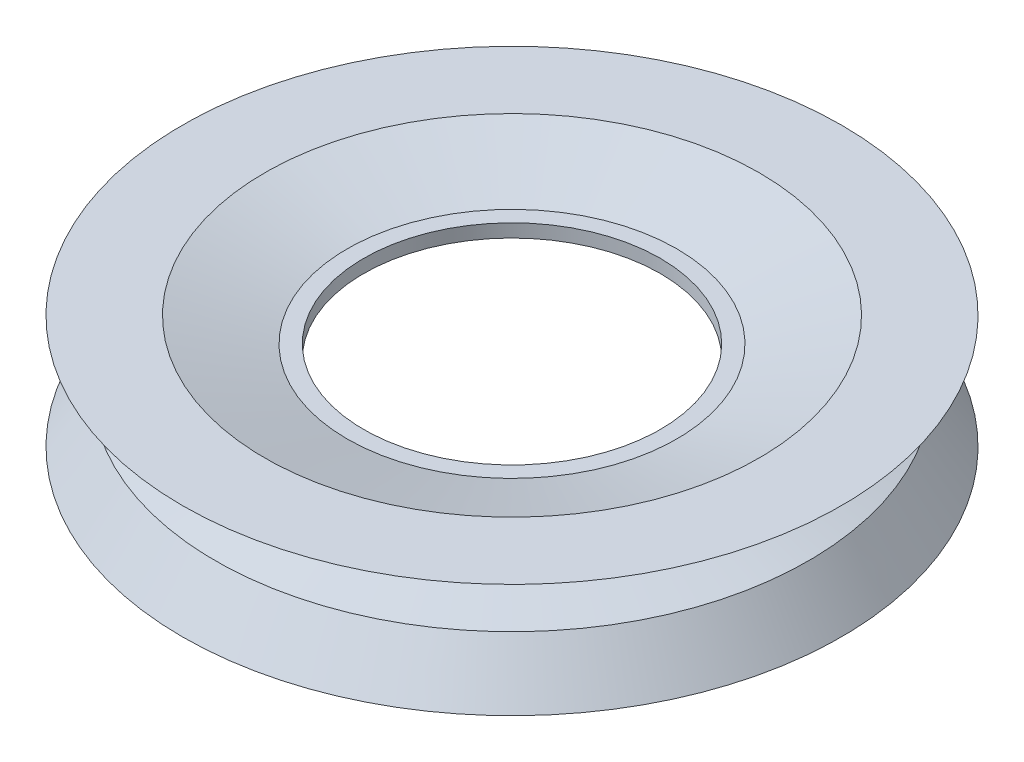
from build123d import *


with BuildPart() as part:
    # Esquisse1 → Révolution1 (revolve)
    with BuildSketch(Plane.XY, mode=Mode.PRIVATE) as r_volution1_sk:
        Polygon((8.5, 0), (10, 0), (9, 1.5), (6, 2.5), (10, 3.45), (7.5, 3.45), (5, 2.7), (4.5, 2.7), (4.5, 2.3), (8.5, 0.8), align=None)
    revolve(r_volution1_sk.sketch.rotate(Axis((0, 0, 0), (0, 1, 0)), 90), axis=Axis((0, 0, 0), (0, 1, 0)))


solid = part.part
